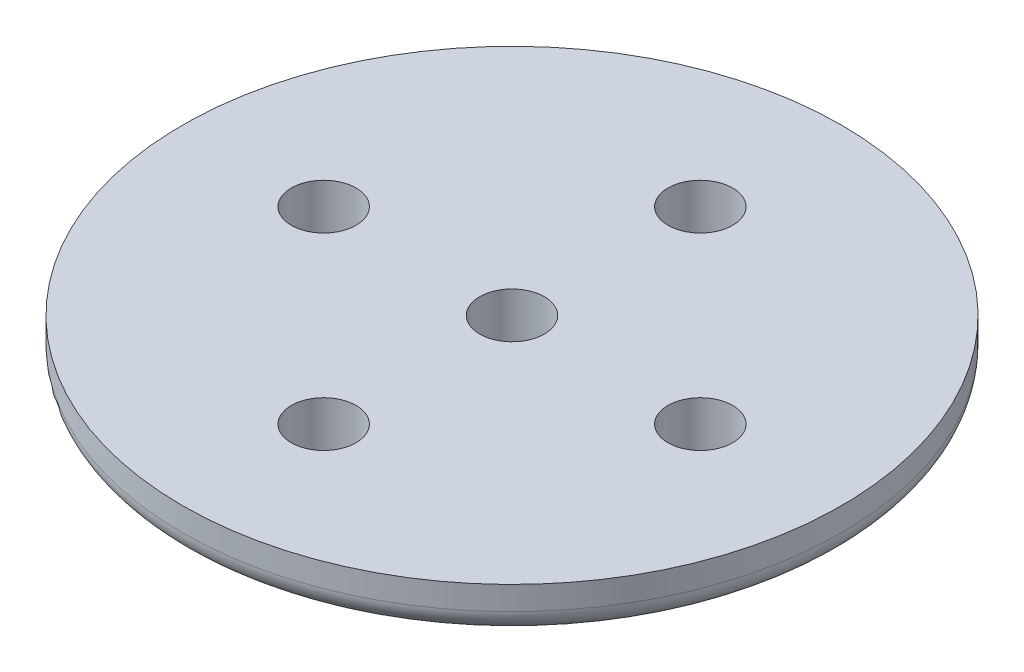
from build123d import *

# Parameters (mm, degrees)
CUT_EXTRUDE1_DEPTH      = 32.590851198
CUT_EXTRUDE1_DEPTH_BACK = 32.590851198
SKETCH2_R               = 2.1828125


with BuildPart() as part:
    # Sketch1 → Revolve1 (revolve)
    with BuildSketch(Plane.XY, mode=Mode.PRIVATE) as revolve1_sk:
        with BuildLine():
            Line((0, 0), (20.6375, 0))
            ThreePointArc((20.6375, 0), (21.760032015, 0.464967985), (22.225, 1.5875))
            Line((22.225, 1.5875), (22.225, 3.175))
            Line((22.225, 3.175), (0, 3.175))
            Line((0, 3.175), (0, 0))
        make_face()
    revolve(revolve1_sk.sketch.rotate(Axis((0, 0, 0), (0, 1, 0)), 90), axis=Axis((0, 0, 0), (0, 1, 0)))

    # Sketch2 → Cut-Extrude1 (cut, two sides: drawn at the far end of the back side and taken through both)
    with BuildSketch(Plane(origin=(0, 3.175, 0), x_dir=(1, 0, 0), z_dir=(0, 1, 0)).offset(-CUT_EXTRUDE1_DEPTH_BACK)):
        with Locations(Location((0, 0, 0), (0, 0, 270))):
            Circle(SKETCH2_R)
        with Locations(Location((12.7, 0, 0), (0, 0, 270))):
            Circle(SKETCH2_R)
        with Locations(Location((-12.7, 0, 0), (0, 0, 270))):
            Circle(SKETCH2_R)
        with Locations(Location((0, 12.7, 0), (0, 0, 270))):
            Circle(SKETCH2_R)
        with Locations(Location((0, -12.7, 0), (0, 0, 270))):
            Circle(SKETCH2_R)
    extrude(amount=CUT_EXTRUDE1_DEPTH + CUT_EXTRUDE1_DEPTH_BACK, mode=Mode.SUBTRACT)


solid = part.part
